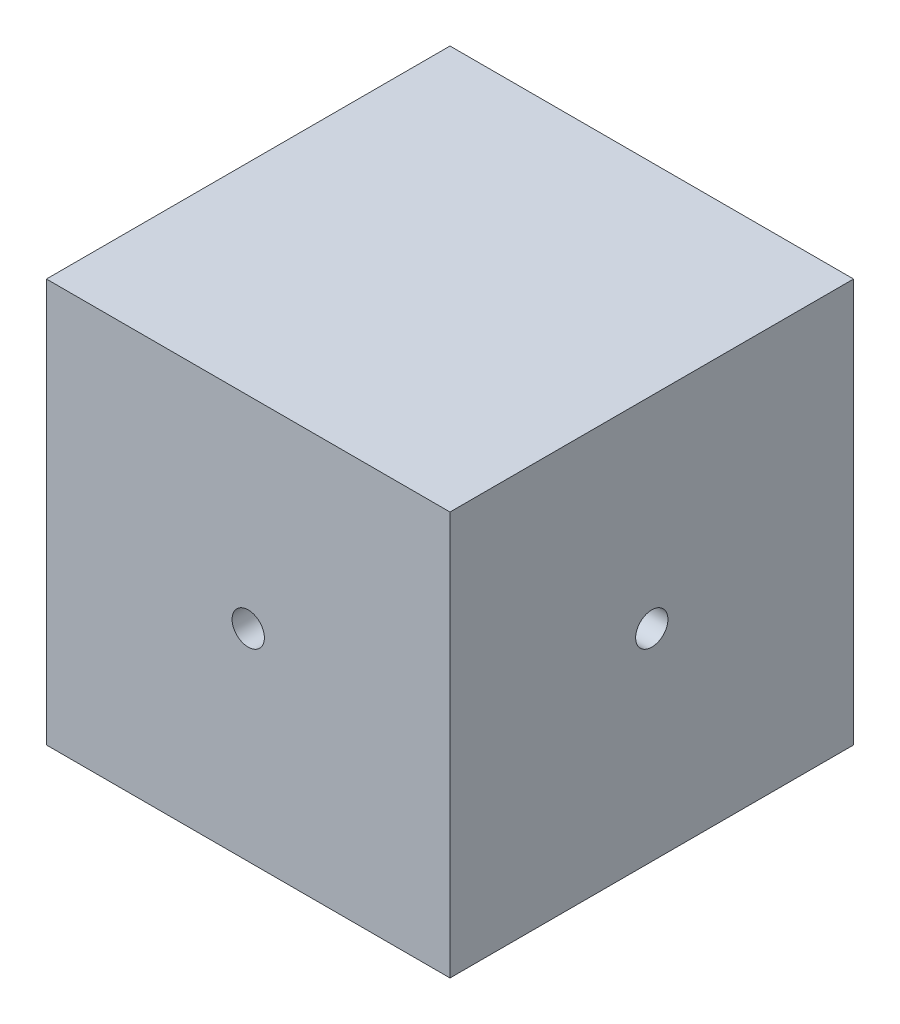
from build123d import *

# Parameters (mm, degrees)
ESBO_O5_W                = 50
ESBO_O5_H                = 50
RESSALTO_EXTRUS_O2_DEPTH = 50
ESBO_O6_R                = 2
CORTE_EXTRUS_O1_DEPTH    = 50
ESBO_O7_R                = 2
CORTE_EXTRUS_O2_DEPTH    = 50


with BuildPart() as part:
    # Esboço5 → Ressalto-extrusão2 (new body)
    with BuildSketch(Plane.XY):
        Rectangle(ESBO_O5_W, ESBO_O5_H)
    extrude(amount=RESSALTO_EXTRUS_O2_DEPTH)

    # Esboço6 → Corte-extrusão1 (cut)
    with BuildSketch(Plane.XY.offset(50)):
        Circle(ESBO_O6_R)
    extrude(amount=-CORTE_EXTRUS_O1_DEPTH, mode=Mode.SUBTRACT)

    # Esboço7 → Corte-extrusão2 (cut)
    with BuildSketch(Plane(origin=(25, 0, 0), x_dir=(0, 0, -1), z_dir=(1, 0, 0))):
        with Locations(Location((-25, 0, 0), (0, 0, 90))):
            Circle(ESBO_O7_R)
    extrude(amount=-CORTE_EXTRUS_O2_DEPTH, mode=Mode.SUBTRACT)


solid = part.part
